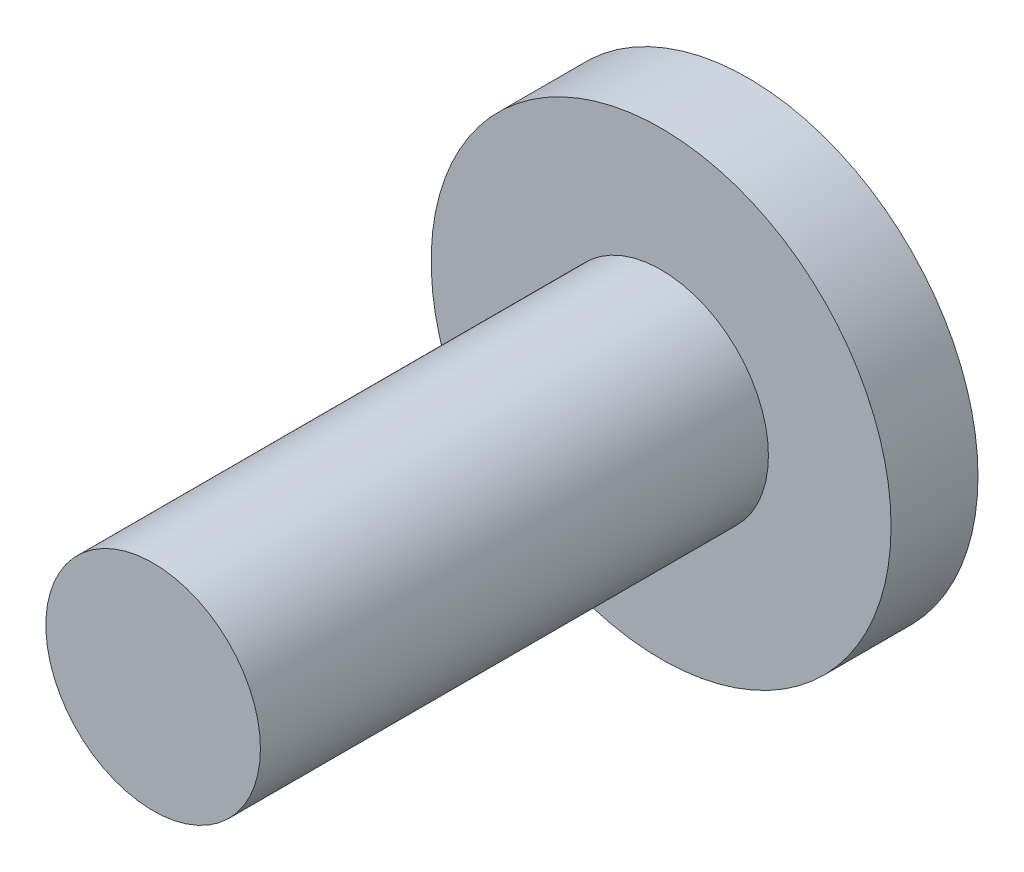
from build123d import *

# Parameters (mm, degrees)
SKETCH1_R   = 8.465
HEAD_DEPTH  = 3.2
SKETCH2_R   = 3.95
SHANK_DEPTH = 18.7


with BuildPart() as part:
    # Sketch1 → Head (new body)
    with BuildSketch(Plane.XY):
        Circle(SKETCH1_R)
    extrude(amount=HEAD_DEPTH)

    # Sketch2 → Shank (add)
    with BuildSketch(Plane.XY.offset(3.2)):
        Circle(SKETCH2_R)
    extrude(amount=SHANK_DEPTH)


solid = part.part
